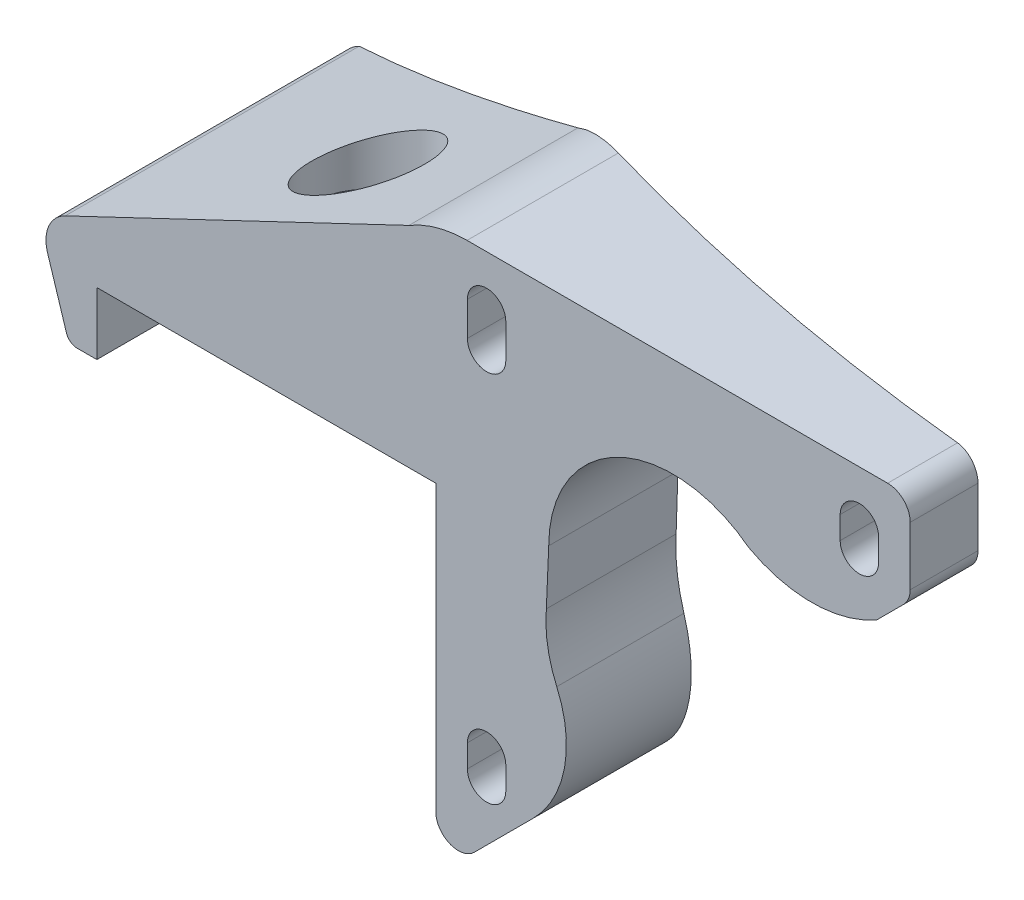
from build123d import *
from build123d.topology import SkipClean

# Parameters (mm, degrees)
RESSALTO_EXTRUS_O1_DEPTH = 6
RESSALTO_EXTRUS_O2_DEPTH = 47.171573
CORTE_EXTRUS_O1_START    = -36
CORTE_EXTRUS_O1_DEPTH    = 36
CORTE_EXTRUS_O2_START    = -6
CORTE_EXTRUS_O2_DEPTH    = 6
CORTE_EXTRUS_O3_DEPTH    = 64.000000167
ESBO_O6_R                = 2.75
CORTE_EXTRUS_O4_DEPTH    = 54.872946739
ESBO_O7_R                = 5
CORTE_EXTRUS_O5_DEPTH    = 16
RESSALTO_EXTRUS_O3_DEPTH = 56
CORTE_EXTRUS_O6_DEPTH    = 56
ESBO_O10_W               = 30
ESBO_O10_H               = 4.954017116
CORTE_EXTRUS_O7_DEPTH    = 56
ESBO_O11_W               = 2.729993951
ESBO_O11_H               = 30
CORTE_EXTRUS_O8_DEPTH    = 56
ESBO_O12_W               = 4.187219241
ESBO_O12_H               = 30
CORTE_EXTRUS_O9_DEPTH    = 56
ESBO_O13_R               = 7.968110823
CORTE_EXTRUS_O10_DEPTH   = 56
FILETE1_R                = 3
FILETE2_R                = 1
ESBO_O14_R               = 5
CORTE_EXTRUS_O11_DEPTH   = 56
CORTE_EXTRUS_O12_DEPTH   = 65.838260479


with BuildPart() as part:
    # Esboço1 → Ressalto-extrusão1 (new body)
    with BuildSketch(Plane.XY):
        with BuildLine():
            Line((-30, 24), (-2.375117905, 40.574929257))
            ThreePointArc((-2.375117905, 40.574929257), (0.100503831, 41.637149282), (2.769839649, 42))
            Line((2.769839649, 42), (40, 42))
            ThreePointArc((40, 42), (41.414213562, 41.414213562), (42, 40))
            Line((42, 40), (42, 34.828427125))
            ThreePointArc((42, 34.828427125), (41.847759065, 34.06306026), (41.414213562, 33.414213562))
            Line((41.414213562, 33.414213562), (36.670641482, 28.670641482))
            ThreePointArc((36.670641482, 28.670641482), (31.432958847, 25.911210894), (25.552715472, 26.597151419))
            ThreePointArc((25.552715472, 26.597151419), (13.045048712, 24.264475098), (10.712372391, 11.756808337))
            ThreePointArc((10.712372391, 11.756808337), (11.398312916, 5.876564962), (8.638882328, 0.638882328))
            Line((8.638882328, 0.638882328), (8, 0))
            Line((8, 0), (6.2, -1.8))
            Line((6.2, -1.8), (3.414213562, -4.585786438))
            ThreePointArc((3.414213562, -4.585786438), (1.234633135, -5.01933194), (0, -3.171572875))
            Line((0, -3.171572875), (0, 0))
            Line((0, 0), (0, 22))
            Line((0, 22), (-30, 22))
            Line((-30, 22), (-30, 24))
        make_face()
        with BuildLine():
            Line((6.2, 37.5), (6.2, 34.5))
            ThreePointArc((6.2, 34.5), (4.5, 32.8), (2.8, 34.5))
            Line((2.8, 34.5), (2.8, 37.5))
            ThreePointArc((2.8, 37.5), (4.5, 39.2), (6.2, 37.5))
        make_face(mode=Mode.SUBTRACT)
        with BuildLine():
            Line((39.2, 37.5), (39.2, 35.5))
            ThreePointArc((39.2, 35.5), (37.5, 33.8), (35.8, 35.5))
            Line((35.8, 35.5), (35.8, 37.5))
            ThreePointArc((35.8, 37.5), (37.5, 39.2), (39.2, 37.5))
        make_face(mode=Mode.SUBTRACT)
        with BuildLine():
            Line((6.2, 3.5), (6.2, 1.5))
            ThreePointArc((6.2, 1.5), (4.5, -0.2), (2.8, 1.5))
            Line((2.8, 1.5), (2.8, 3.5))
            ThreePointArc((2.8, 3.5), (4.5, 5.2), (6.2, 3.5))
        make_face(mode=Mode.SUBTRACT)
    extrude(amount=RESSALTO_EXTRUS_O1_DEPTH)

    # Esboço2 → Ressalto-extrusão2 (add, through all)
    with BuildSketch(Plane(origin=(0, 42, 0), x_dir=(1, 0, 0), z_dir=(0, 1, 0))):
        with BuildLine():
            Line((-30, 0), (-30, 20))
            ThreePointArc((-30, 20), (5.092783278, 6.734019802), (42, 0))
            Line((42, 0), (-30, 0))
        make_face()
    extrude(amount=-RESSALTO_EXTRUS_O2_DEPTH)

    # Esboço3 → Corte-extrusão1 (cut)
    with BuildSketch(Plane.XY.offset(CORTE_EXTRUS_O1_START)):
        with BuildLine():
            ThreePointArc((2.8, 34.5), (4.5, 32.8), (6.2, 34.5))
            Line((6.2, 34.5), (6.2, 37.5))
            ThreePointArc((6.2, 37.5), (4.5, 39.2), (2.8, 37.5))
            Line((2.8, 37.5), (2.8, 34.5))
        make_face()
        with BuildLine():
            Line((0, -3.171572875), (0, 22))
            Line((0, 22), (-30, 22))
            Line((-30, 22), (-30, -5.171572875))
            Line((-30, -5.171572875), (2, -5.171572875))
            ThreePointArc((2, -5.171572875), (0.585786438, -4.585786438), (0, -3.171572875))
        make_face()
        with BuildLine():
            ThreePointArc((3.414213562, -4.585786438), (2.765366865, -5.01933194), (2, -5.171572875))
            Line((2, -5.171572875), (42, -5.171572875))
            Line((42, -5.171572875), (42, 34.828427125))
            ThreePointArc((42, 34.828427125), (41.847759065, 34.06306026), (41.414213562, 33.414213562))
            Line((41.414213562, 33.414213562), (36.670641482, 28.670641482))
            ThreePointArc((36.670641482, 28.670641482), (31.432958847, 25.911210894), (25.552715472, 26.597151419))
            ThreePointArc((25.552715472, 26.597151419), (13.045048712, 24.264475098), (10.712372391, 11.756808337))
            ThreePointArc((10.712372391, 11.756808337), (11.398312916, 5.876564962), (8.638882328, 0.638882328))
            Line((8.638882328, 0.638882328), (3.414213562, -4.585786438))
        make_face()
        with BuildLine():
            ThreePointArc((35.8, 35.5), (37.5, 33.8), (39.2, 35.5))
            Line((39.2, 35.5), (39.2, 37.5))
            ThreePointArc((39.2, 37.5), (37.5, 39.2), (35.8, 37.5))
            Line((35.8, 37.5), (35.8, 35.5))
        make_face()
        with BuildLine():
            ThreePointArc((2.8, 1.5), (4.5, -0.2), (6.2, 1.5))
            Line((6.2, 1.5), (6.2, 3.5))
            ThreePointArc((6.2, 3.5), (4.5, 5.2), (2.8, 3.5))
            Line((2.8, 3.5), (2.8, 1.5))
        make_face()
        with BuildLine():
            Line((-30, 42), (-30, 24))
            Line((-30, 24), (-2.375117905, 40.574929257))
            ThreePointArc((-2.375117905, 40.574929257), (0.100503831, 41.637149282), (2.769839649, 42))
            Line((2.769839649, 42), (-30, 42))
        make_face()
    extrude(amount=CORTE_EXTRUS_O1_DEPTH, mode=Mode.SUBTRACT)

    # Esboço4 → Corte-extrusão2 (cut)
    with BuildSketch(Plane.XY.offset(CORTE_EXTRUS_O2_START)):
        with BuildLine():
            Line((42, 40), (42, 42))
            Line((42, 42), (40, 42))
            ThreePointArc((40, 42), (41.414213562, 41.414213562), (42, 40))
        make_face()
    extrude(amount=CORTE_EXTRUS_O2_DEPTH, mode=Mode.SUBTRACT)

    # Esboço5 → Corte-extrusão3 (cut, through all)
    with BuildSketch(Plane.XY.offset(1)):
        with BuildLine():
            Line((1.3, 37.5), (1.3, 34.5))
            ThreePointArc((1.3, 34.5), (4.5, 31.3), (7.7, 34.5))
            Line((7.7, 34.5), (7.7, 37.5))
            ThreePointArc((7.7, 37.5), (4.5, 40.7), (1.3, 37.5))
        make_face()
        with BuildLine():
            Line((40.2, 35.5), (40.2, 37.5))
            ThreePointArc((40.2, 37.5), (37.5, 40.2), (34.8, 37.5))
            Line((34.8, 37.5), (34.8, 35.5))
            ThreePointArc((34.8, 35.5), (37.5, 32.8), (40.2, 35.5))
        make_face()
        with BuildLine():
            Line((1.8, 3.5), (1.8, 1.5))
            ThreePointArc((1.8, 1.5), (4.5, -1.2), (7.2, 1.5))
            Line((7.2, 1.5), (7.2, 3.5))
            ThreePointArc((7.2, 3.5), (4.5, 6.2), (1.8, 3.5))
        make_face()
    extrude(amount=-CORTE_EXTRUS_O3_DEPTH, mode=Mode.SUBTRACT)

    # Esboço6 → Corte-extrusão4 (cut, through all)
    with BuildSketch(Plane.XZ.offset(-22)):
        with Locations((-15, -3)):
            Circle(ESBO_O6_R)
    extrude(amount=-CORTE_EXTRUS_O4_DEPTH, mode=Mode.SUBTRACT)

    # Esboço7 → Corte-extrusão5 (cut)
    with BuildSketch(Plane(origin=(0, 29, 0), x_dir=(-1, 0, 0), z_dir=(0, -1, 0))):
        with Locations(Location((15, 3, 0), (0, 0, 180))):
            Circle(ESBO_O7_R)
    extrude(amount=-CORTE_EXTRUS_O5_DEPTH, mode=Mode.SUBTRACT)

    # Esboço8 → Ressalto-extrusão3 (add)
    with BuildSketch(Plane.XY.offset(6)):
        Polygon((-30, 22), (-30, 16.475897374), (-32.468121282, 16.475897374), (-35.151943697, 24.974668355), (-2.375117905, 40.574929257), align=None)
    extrude(amount=-RESSALTO_EXTRUS_O3_DEPTH)

    # Esboço9 → Corte-extrusão6 (cut)
    with BuildSketch(Plane(origin=(-19.527562648, 29.041651157, 0), x_dir=(0.8298484461977135, 0.5579888496585221, 0), z_dir=(0.5579888496585221, -0.8298484461977135, 0))):
        with BuildLine():
            Line((20.669370198, -50), (20.669370198, -8.960218673))
            add(Edge.make_bspline(
                [(20.669370198, -8.960218673), (3.547051305, -13.487974371), (-12.619698693, -20)],
                knots=[1.879279318, 1.879279318, 1.879279318, 2.02269118, 2.02269118, 2.02269118], degree=2, weights=[1, 0.997430231, 1]))
            Line((-12.619698693, -20), (-12.619698693, -50))
            Line((-12.619698693, -50), (20.669370198, -50))
        make_face()
    extrude(amount=-CORTE_EXTRUS_O6_DEPTH, mode=Mode.SUBTRACT)

    # Esboço10 → Corte-extrusão7 (cut)
    with BuildSketch(Plane(origin=(-10.472437352, -7.041651157, 0), x_dir=(0, 0, -1), z_dir=(0.8298484461977135, 0.5579888496585221, 1.5073885260129385e-15))):
        with Locations((35, 37.473339864)):
            Rectangle(ESBO_O10_W, ESBO_O10_H)
    extrude(amount=-CORTE_EXTRUS_O7_DEPTH, mode=Mode.SUBTRACT)

    # Esboço11 → Corte-extrusão8 (cut)
    with BuildSketch(Plane(origin=(-22.291848959, 33.152734563, 0), x_dir=(0.8298484461977135, 0.5579888496585221, 0), z_dir=(0.5579888496585221, -0.8298484461977135, 0))):
        with Locations((-13.984695669, -35)):
            Rectangle(ESBO_O11_W, ESBO_O11_H)
    extrude(amount=-CORTE_EXTRUS_O8_DEPTH, mode=Mode.SUBTRACT)

    # Esboço12 → Corte-extrusão9 (cut)
    with BuildSketch(Plane(origin=(-19.527562648, 29.041651157, 0), x_dir=(0.8298484461977135, 0.5579888496585221, 0), z_dir=(-0.5579888496585221, 0.8298484461977135, 0))):
        with Locations((-14.713308314, 35)):
            Rectangle(ESBO_O12_W, ESBO_O12_H)
    extrude(amount=-CORTE_EXTRUS_O9_DEPTH, mode=Mode.SUBTRACT)

    # Esboço13 → Corte-extrusão10 (cut)
    with BuildSketch(Plane(origin=(0, 0, -20), x_dir=(-1, 0, 0), z_dir=(0, 0, -1))):
        with Locations((34.361612589, 20.650995678)):
            Circle(ESBO_O13_R)
    extrude(amount=CORTE_EXTRUS_O10_DEPTH, mode=Mode.SUBTRACT)

    # Filete1
    filete1_edges = [part.edges().sort_by_distance(p)[0] for p in [
        (-35.151943697, 24.974668355, -7),
    ]]
    fillet(filete1_edges, radius=FILETE1_R)

    # Filete2
    filete2_edges = [part.edges().sort_by_distance(p)[0] for p in [
        (-32.468121282, 16.475897374, -7),
    ]]
    fillet(filete2_edges, radius=FILETE2_R)

    # Esboço14 → Corte-extrusão11 (cut)
    with SkipClean():  # the faces are left unmerged after this step: merging them gives an invalid solid
        with BuildSketch(Plane(origin=(0, 29, 0), x_dir=(1, 0, 0), z_dir=(0, 1, 0))):
            with Locations((-15, 3)):
                Circle(ESBO_O14_R)
        extrude(amount=CORTE_EXTRUS_O11_DEPTH, mode=Mode.SUBTRACT)

    # Esboço15 → Corte-extrusão12 (cut, through all)
    with SkipClean():  # the faces are left unmerged after this step: merging them gives an invalid solid
        with BuildSketch(Plane.XY.offset(6)):
            with BuildLine():
                Line((9.75, 16.30952381), (10, 22.2))
                ThreePointArc((10, 22.2), (16.149553965, 32.072850311), (27.722395139, 30.906859571))
                ThreePointArc((27.722395139, 30.906859571), (33.400143909, 29.493959096), (39.042427522, 31.042427522))
                Line((39.042427522, 31.042427522), (40.056737405, 6.935592927))
                Line((40.056737405, 6.935592927), (14.498143353, 9.675700977))
                Line((14.498143353, 9.675700977), (9.75, 16.30952381))
            make_face()
        extrude(amount=-CORTE_EXTRUS_O12_DEPTH, mode=Mode.SUBTRACT)


solid = part.part
